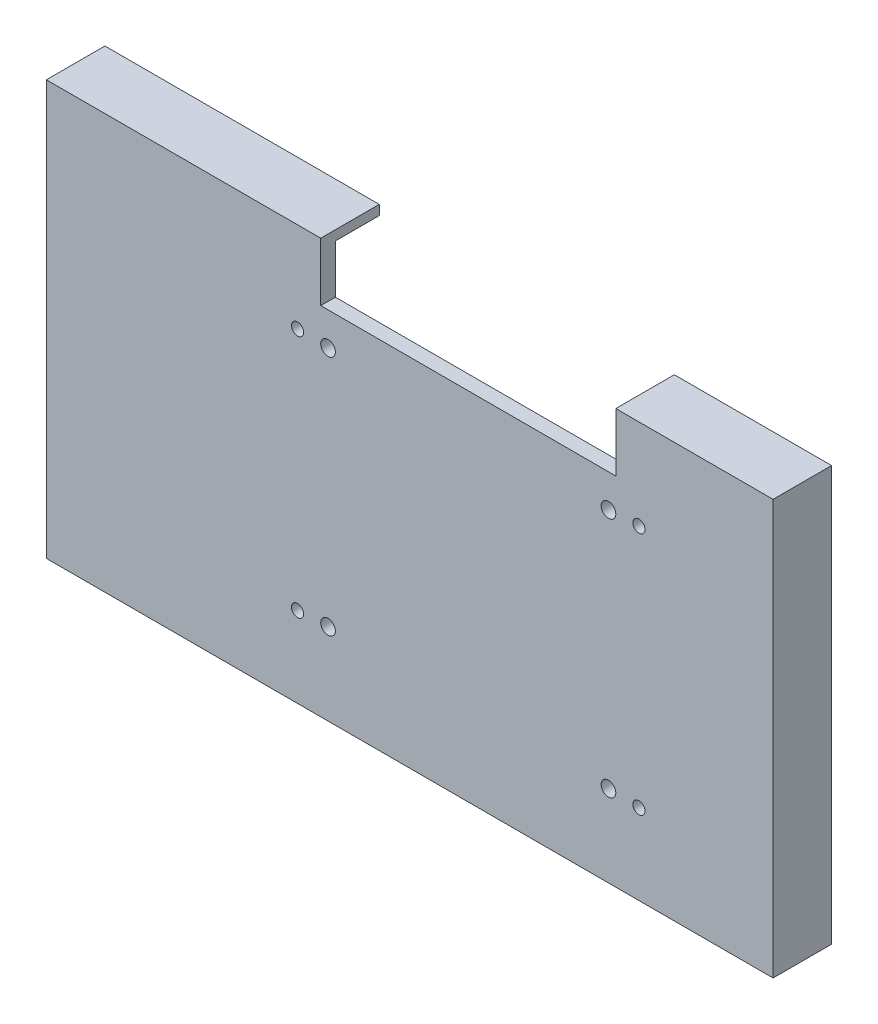
from build123d import *

# Parameters (mm, degrees)
SKETCH_1_R      = 1.25
SKETCH_1_R_2    = 1.5
EXTRUDE_2_DEPTH = 3
EXTRUDE_3_DEPTH = 12
SKETCH_1_4_W    = 20.839933765
SKETCH_1_4_H    = 15
SKETCH_1_4_W_2  = 2
EXTRUDE_4_DEPTH = 1


with BuildPart() as part:
    # 草图1 → 凸台-拉伸2 (new body)
    with BuildSketch(Plane.XY):
        Polygon((-30.25, 31.520504216), (-30.25, 41.5), (-84.5, 41.5), (-84.5, -15), (-63.660066235, -15), (-63.660066235, -30), (-84.5, -30), (-84.5, -39.5), (60.5, -39.5), (60.5, 41.5), (30.25, 41.5), (30.25, 31.520504216), align=None)
        with Locations((-35, -25)):
            Circle(SKETCH_1_R, mode=Mode.SUBTRACT)
        with Locations((-28.75, -24.75)):
            Circle(SKETCH_1_R_2, mode=Mode.SUBTRACT)
        with Locations((28.75, -24.75)):
            Circle(SKETCH_1_R_2, mode=Mode.SUBTRACT)
        with Locations((35, -25)):
            Circle(SKETCH_1_R, mode=Mode.SUBTRACT)
        with Locations((-35, 25)):
            Circle(SKETCH_1_R, mode=Mode.SUBTRACT)
        with Locations((-28.75, 24.75)):
            Circle(SKETCH_1_R_2, mode=Mode.SUBTRACT)
        with Locations((28.75, 24.75)):
            Circle(SKETCH_1_R_2, mode=Mode.SUBTRACT)
        with Locations((35, 25)):
            Circle(SKETCH_1_R, mode=Mode.SUBTRACT)
    extrude(amount=-EXTRUDE_2_DEPTH)

    # 草图1<3> → 凸台-拉伸3 (add)
    with BuildSketch(Plane.XY):
        Polygon((-30.25, 43.5), (-86.5, 43.5), (-86.5, -15), (-84.5, -15), (-84.5, 41.5), (-30.25, 41.5), align=None)
        Polygon((62.5, 43.5), (30.25, 43.5), (30.25, 41.5), (60.5, 41.5), (60.5, -39.5), (-84.5, -39.5), (-84.5, -30), (-86.5, -30), (-86.5, -41.5), (62.5, -41.5), align=None)
    extrude(amount=-EXTRUDE_3_DEPTH)

    # 草图1<4> → 凸台-拉伸4 (add)
    with BuildSketch(Plane.XY):
        with Locations((-74.080033117, -22.5)):
            Rectangle(SKETCH_1_4_W, SKETCH_1_4_H)
        with Locations((-85.5, -22.5)):
            Rectangle(SKETCH_1_4_W_2, SKETCH_1_4_H)
    extrude(amount=-EXTRUDE_4_DEPTH)


solid = part.part
